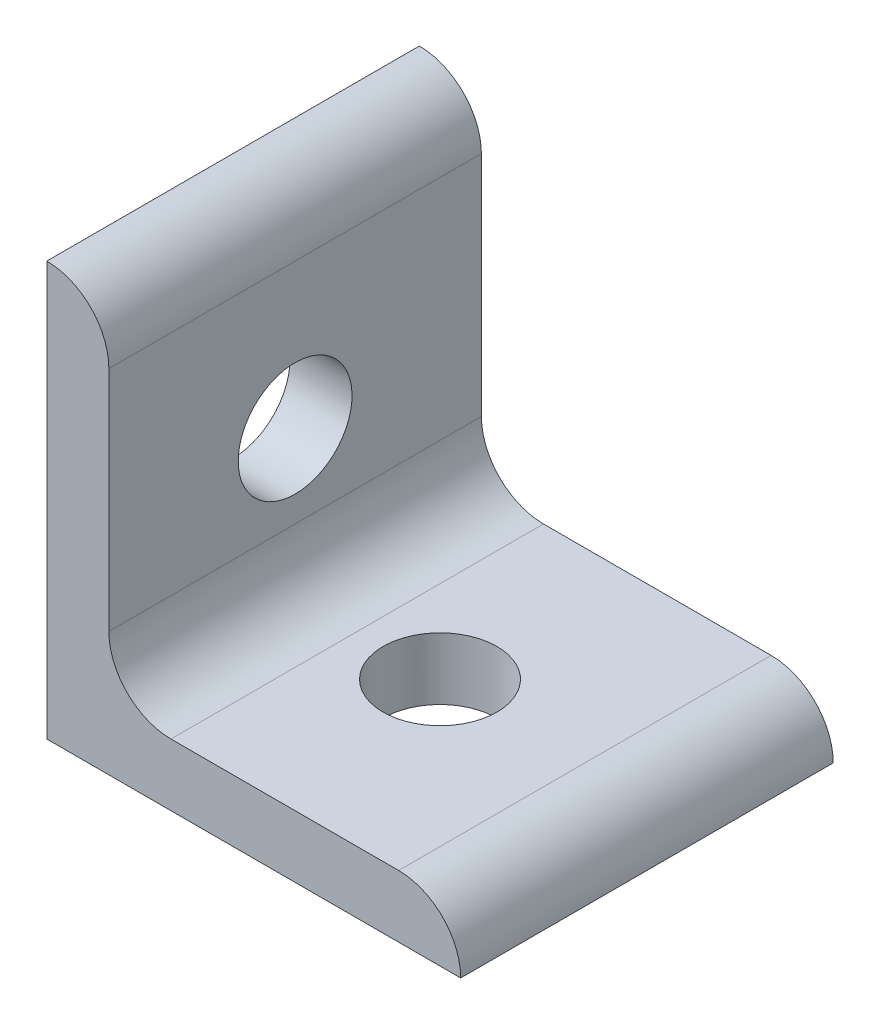
from build123d import *

# Parameters (mm, degrees)
BOSS_EXTRUDE1_DEPTH = 9
SKETCH2_R           = 2.75
CUT_EXTRUDE1_DEPTH  = 30.681644159
SKETCH3_R           = 2.75
CUT_EXTRUDE2_DEPTH  = 30.681644159


with BuildPart() as part:
    # Sketch1 → Boss-Extrude1 (new, symmetric)
    with BuildSketch(Plane.XY):
        with BuildLine():
            Line((0, 0), (0, 20))
            ThreePointArc((0, 20), (2.121320344, 19.121320344), (3, 17))
            Line((3, 17), (3, 6))
            ThreePointArc((3, 6), (3.878679656, 3.878679656), (6, 3))
            Line((6, 3), (17, 3))
            ThreePointArc((17, 3), (19.121320344, 2.121320344), (20, 0))
            Line((20, 0), (0, 0))
        make_face()
    extrude(amount=BOSS_EXTRUDE1_DEPTH, both=True)

    # Sketch2 → Cut-Extrude1 (cut, through all)
    with BuildSketch(Plane(origin=(0, 0, 0), x_dir=(1, 0, 0), z_dir=(0, 1, 0))):
        with Locations((10, 0)):
            Circle(SKETCH2_R)
    extrude(amount=CUT_EXTRUDE1_DEPTH, mode=Mode.SUBTRACT)

    # Sketch3 → Cut-Extrude2 (cut, through all)
    with BuildSketch(Plane(origin=(0, 0, 0), x_dir=(0, 0, -1), z_dir=(1, 0, 0))):
        with Locations(Location((0, 10, 0), (0, 0, 270))):
            Circle(SKETCH3_R)
    extrude(amount=CUT_EXTRUDE2_DEPTH, mode=Mode.SUBTRACT)


solid = part.part
